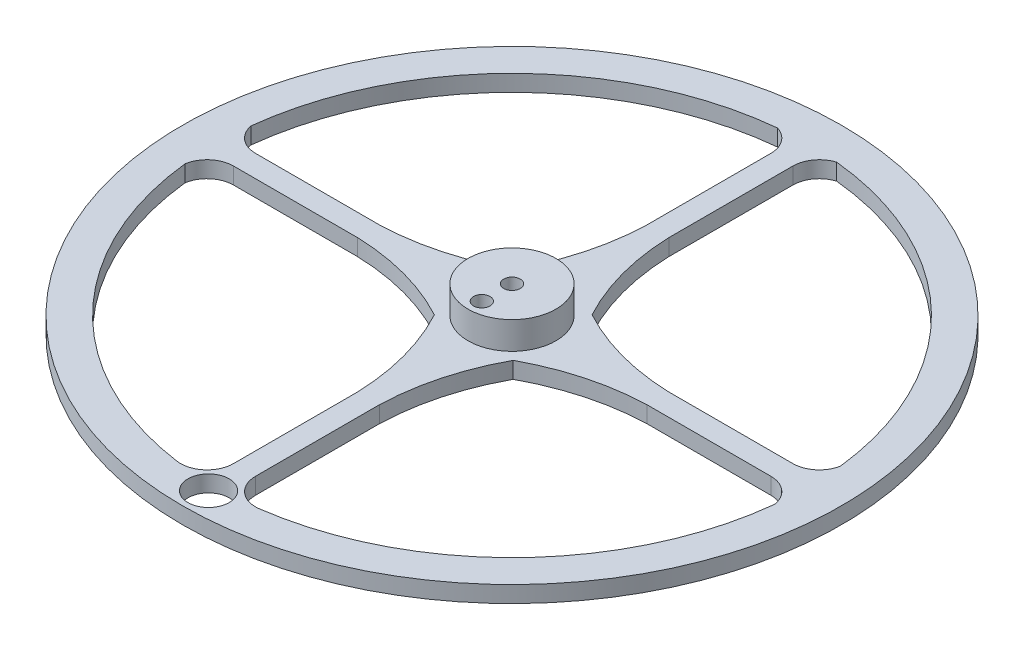
from build123d import *

# Parameters (mm, degrees)
SKETCH1_R           = 60
SKETCH1_R_2         = 54
SKETCH1_R_3         = 8
BOSS_EXTRUDE1_DEPTH = 3
SKETCH1_3_R         = 8
BOSS_EXTRUDE2_DEPTH = 5
CUT_EXTRUDE1_REACH  = 87.229
SKETCH2_R           = 1.5
CUT_EXTRUDE2_REACH  = 87
SKETCH3_R           = 3.75
SKETCH4_R           = 1.5
CUT_EXTRUDE3_DEPTH  = 5


with BuildPart() as part:
    # Sketch1 → Boss-Extrude1 (new body)
    # profile 1 of 3: a face of its own
    with BuildSketch(Plane(origin=(0, 0, 0), x_dir=(1, 0, 0), z_dir=(0, 1, 0))):
        with Locations(Location((0, 0, 0), (0, 0, 270))):
            Circle(SKETCH1_R)
        Circle(SKETCH1_R_2, mode=Mode.SUBTRACT)
    # profile 2 of 3: a face of its own
    with BuildSketch(Plane(origin=(0, 0, 0), x_dir=(1, 0, 0), z_dir=(0, 1, 0))):
        with BuildLine():
            ThreePointArc((7.5, -53.47663041), (3.660460389, -52.338407931), (2.000000204, -48.694167705))
            Line((2.000000204, -48.694167705), (2.000000204, -26.109482291))
            ThreePointArc((2.000000204, -26.109482291), (3.464837403, -16.231345149), (7.178910038, -6.961555191))
            ThreePointArc((7.178910038, -6.961555191), (16.451417639, -3.257530466), (26.326837138, -1.782645358))
            Line((26.326837138, -1.782645358), (48.911522552, -1.782645358))
            ThreePointArc((48.911522552, -1.782645358), (52.048100377, -2.939896306), (53.681424467, -5.857018624))
            ThreePointArc((53.681424467, -5.857018624), (53.920297297, -2.93283811), (54, 0))
            ThreePointArc((54, 0), (53.912855321, 3.066599276), (53.651702551, 6.123300855))
            ThreePointArc((53.651702551, 6.123300855), (51.982585847, 3.31964037), (48.911522552, 2.217355051))
            Line((48.911522552, 2.217355051), (26.326837138, 2.217355051))
            ThreePointArc((26.326837138, 2.217355051), (16.448699996, 3.682192249), (7.178910038, 7.396264884))
            ThreePointArc((7.178910038, 7.396264884), (3.474885313, 16.668772485), (2.000000204, 26.544191985))
            Line((2.000000204, 26.544191985), (2.000000204, 49.128877399))
            ThreePointArc((2.000000204, 49.128877399), (2.932488129, 51.981408674), (5.369841962, 53.732344052))
            ThreePointArc((5.369841962, 53.732344052), (0, 54), (-5.369841962, 53.732344052))
            ThreePointArc((-5.369841962, 53.732344052), (-2.932488129, 51.981408674), (-2.000000204, 49.128877399))
            Line((-2.000000204, 49.128877399), (-2.000000204, 26.544191985))
            ThreePointArc((-2.000000204, 26.544191985), (-3.464837403, 16.666054843), (-7.178910038, 7.396264884))
            ThreePointArc((-7.178910038, 7.396264884), (-16.451417639, 3.69224016), (-26.326837138, 2.217355051))
            Line((-26.326837138, 2.217355051), (-48.911522552, 2.217355051))
            ThreePointArc((-48.911522552, 2.217355051), (-51.982585847, 3.31964037), (-53.651702551, 6.123300855))
            ThreePointArc((-53.651702551, 6.123300855), (-53.99983382, 0.133967924), (-53.681424467, -5.857018624))
            ThreePointArc((-53.681424467, -5.857018624), (-52.048100377, -2.939896306), (-48.911522552, -1.782645358))
            Line((-48.911522552, -1.782645358), (-26.326837138, -1.782645358))
            ThreePointArc((-26.326837138, -1.782645358), (-16.448699996, -3.247482556), (-7.178910038, -6.961555191))
            ThreePointArc((-7.178910038, -6.961555191), (-3.474885313, -16.234062792), (-2.000000204, -26.109482291))
            Line((-2.000000204, -26.109482291), (-2.000000204, -48.694167705))
            ThreePointArc((-2.000000204, -48.694167705), (-3.660460389, -52.338407931), (-7.5, -53.47663041))
            ThreePointArc((-7.5, -53.47663041), (0, -54), (7.5, -53.47663041))
        make_face()
        Circle(SKETCH1_R_3, mode=Mode.SUBTRACT)
    # profile 3 of 3: a face of its own
    with BuildSketch(Plane(origin=(0, 0, 0), x_dir=(1, 0, 0), z_dir=(0, 1, 0))):
        Circle(SKETCH1_R_3)
    extrude(amount=-BOSS_EXTRUDE1_DEPTH)

    # Sketch1<3> → Boss-Extrude2 (add)
    with BuildSketch(Plane(origin=(0, 0, 0), x_dir=(1, 0, 0), z_dir=(0, 1, 0))):
        with Locations(Location((0, 0, 0), (0, 0, 270))):
            Circle(SKETCH1_3_R)
    extrude(amount=BOSS_EXTRUDE2_DEPTH)

    # Sketch2 → Cut-Extrude1 (cut, up to next)
    with BuildSketch(Plane(origin=(0, 5, 0), x_dir=(1, 0, 0), z_dir=(0, 1, 0)), mode=Mode.PRIVATE) as cut_extrude1_sk1:
        with Locations(Location((0, 0, 0), (0, 0, 270))):
            Circle(SKETCH2_R)
    cut_extrude1_tool1 = extrude(cut_extrude1_sk1.sketch, amount=-CUT_EXTRUDE1_REACH, mode=Mode.PRIVATE) & part.part
    add(cut_extrude1_tool1.solids().sort_by_distance((0, 5, 0))[0], mode=Mode.SUBTRACT)

    # Sketch3 → Cut-Extrude2 (cut, up to next)
    with BuildSketch(Plane(origin=(0, 0, 0), x_dir=(1, 0, 0), z_dir=(0, 1, 0)), mode=Mode.PRIVATE) as cut_extrude2_sk1:
        with Locations(Location((0, -55.25, 0), (0, 0, 270))):
            Circle(SKETCH3_R)
    cut_extrude2_tool1 = extrude(cut_extrude2_sk1.sketch, amount=-CUT_EXTRUDE2_REACH, mode=Mode.PRIVATE) & part.part
    add(cut_extrude2_tool1.solids().sort_by_distance((0, 0, 55.25))[0], mode=Mode.SUBTRACT)

    # Sketch4 → Cut-Extrude3 (cut)
    with BuildSketch(Plane(origin=(0, 5, 0), x_dir=(1, 0, 0), z_dir=(0, 1, 0))):
        with Locations(Location((0, -5.5, 0), (0, 0, 270))):
            Circle(SKETCH4_R)
    extrude(amount=-CUT_EXTRUDE3_DEPTH, mode=Mode.SUBTRACT)


solid = part.part
